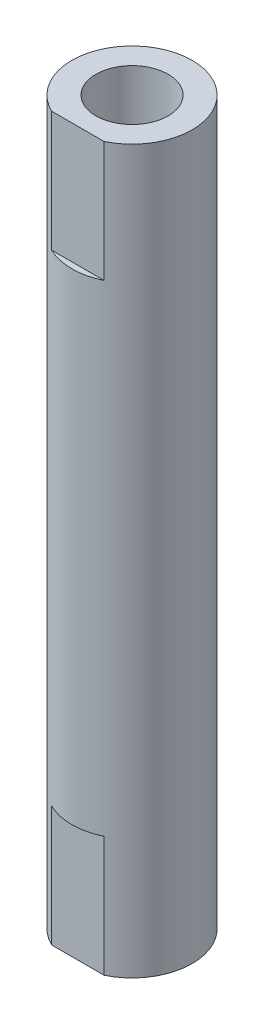
from build123d import *

# Parameters (mm, degrees)
SKETCH1_R           = 5
SKETCH1_R_2         = 3
BOSS_EXTRUDE1_DEPTH = 30
CUT_EXTRUDE1_START  = -10
CUT_EXTRUDE1_DEPTH  = 10


with BuildPart() as part:
    # Sketch1 → Boss-Extrude1 (new, symmetric)
    with BuildSketch(Plane(origin=(0, 0, 0), x_dir=(1, 0, 0), z_dir=(0, 1, 0))):
        with Locations(Location((0, 0, 0), (0, 0, 270))):
            Circle(SKETCH1_R)
        with Locations(Location((0, 0, 0), (0, 0, 270))):
            Circle(SKETCH1_R_2, mode=Mode.SUBTRACT)
    extrude(amount=BOSS_EXTRUDE1_DEPTH, both=True)

    # Sketch2 → Cut-Extrude1 (cut)
    with BuildSketch(Plane(origin=(0, -30, 0), x_dir=(-1, 0, 0), z_dir=(0, -1, 0)).offset(CUT_EXTRUDE1_START)):
        with BuildLine():
            Line((2.179449472, -4.5), (-2.179449472, -4.5))
            ThreePointArc((-2.179449472, -4.5), (0, -5), (2.179449472, -4.5))
        make_face()
    cut_extrude1 = extrude(amount=CUT_EXTRUDE1_DEPTH, mode=Mode.SUBTRACT)

    # Mirror1: Cut-Extrude1 across plane
    add(cut_extrude1.mirror(Plane.ZX), mode=Mode.SUBTRACT)


solid = part.part
